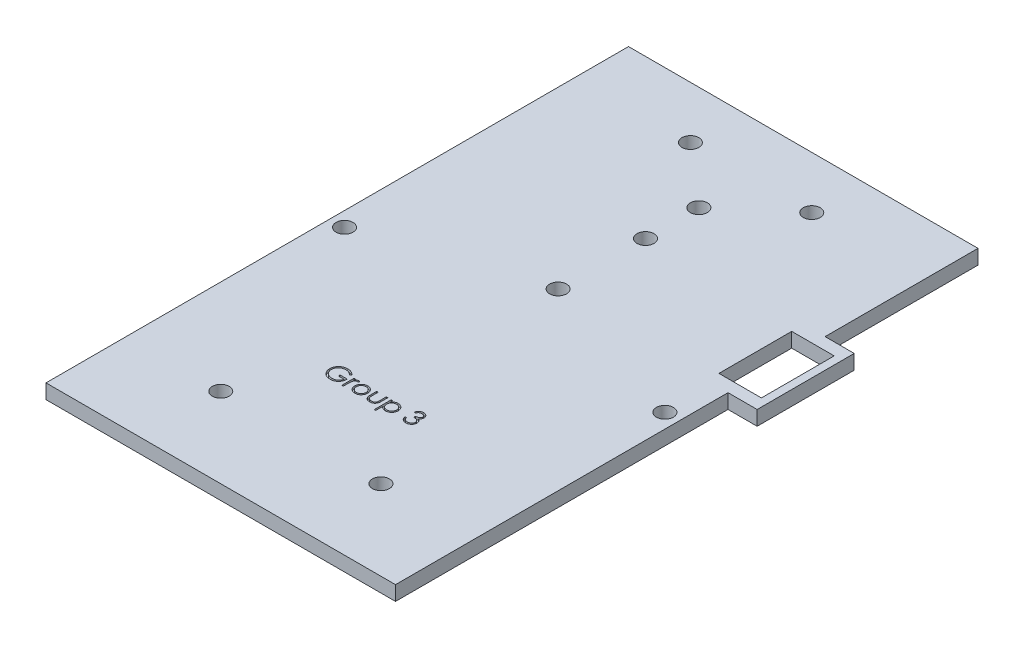
from build123d import *

# Parameters (mm, degrees)
SKETCH1_W           = 8.75
SKETCH1_H           = 15
SKETCH1_R           = 1.75
BOSS_EXTRUDE1_DEPTH = 3
CUT_EXTRUDE1_DEPTH  = 0.5


with BuildPart() as part:
    # Sketch1 → Boss-Extrude1 (new body)
    with BuildSketch(Plane(origin=(0, 0, 0), x_dir=(1, 0, 0), z_dir=(0, 1, 0))):
        Polygon((-36, -60), (36, -60), (36, 8.5), (42, 8.5), (42, 28.5), (36, 28.5), (36, 60), (-36, 60), align=None)
        with Locations((36, 18.5)):
            Rectangle(SKETCH1_W, SKETCH1_H, mode=Mode.SUBTRACT)
        with Locations(Location((-16.5, -43.5, 0), (0, 0, 270))):
            Circle(SKETCH1_R, mode=Mode.SUBTRACT)
        with Locations(Location((-33, -1.5, 0), (0, 0, 270))):
            Circle(SKETCH1_R, mode=Mode.SUBTRACT)
        with Locations(Location((16.5, -43.5, 0), (0, 0, 270))):
            Circle(SKETCH1_R, mode=Mode.SUBTRACT)
        with Locations(Location((33, -1.5, 0), (0, 0, 270))):
            Circle(SKETCH1_R, mode=Mode.SUBTRACT)
        with Locations(Location((0, 38.5, 0), (0, 0, 270))):
            Circle(SKETCH1_R, mode=Mode.SUBTRACT)
        with Locations(Location((-12.5, 49.25, 0), (0, 0, 270))):
            Circle(SKETCH1_R, mode=Mode.SUBTRACT)
        with Locations(Location((0, 9.5, 0), (0, 0, 270))):
            Circle(SKETCH1_R, mode=Mode.SUBTRACT)
        with Locations(Location((0, 27.5, 0), (0, 0, 270))):
            Circle(SKETCH1_R, mode=Mode.SUBTRACT)
        with Locations(Location((12.5, 49.25, 0), (0, 0, 270))):
            Circle(SKETCH1_R, mode=Mode.SUBTRACT)
    extrude(amount=BOSS_EXTRUDE1_DEPTH)

    # Sketch2 → Cut-Extrude1 (cut)
    # profile 1 of 6: a face of its own
    with BuildSketch(Plane(origin=(0, 3, 0), x_dir=(1, 0, 0), z_dir=(0, 1, 0))):
        with BuildLine():
            Line((-5.855769231, -27.097355769), (-6.125, -27.352564103))
            add(Edge.make_bspline(
                [(-6.125, -27.352564103), (-6.173718888, -27.30673324), (-6.269994935, -27.216164377), (-6.426955177, -27.098653381), (-6.590718811, -26.997987281), (-6.760431308, -26.916081045), (-6.931889862, -26.850728284), (-7.102818638, -26.804200144), (-7.27146434, -26.774527607), (-7.383631558, -26.770979237), (-7.438902244, -26.769230769)],
                knots=[0, 0, 0, 0, 1.08915593, 2.152340314, 3.188132944, 4.216796309, 5.218260357, 6.173443236, 7.099959455, 8, 8, 8, 8], degree=3))
            add(Edge.make_bspline(
                [(-7.438902244, -26.769230769), (-7.472816944, -26.769644375), (-7.540558384, -26.770470514), (-7.641180328, -26.781014729), (-7.740746965, -26.796179594), (-7.83907034, -26.818121471), (-7.936341626, -26.845930531), (-8.032222519, -26.880715994), (-8.126891873, -26.921271238), (-8.219457954, -26.968133712), (-8.309198458, -27.019613558), (-8.393955294, -27.076662099), (-8.474268692, -27.137450889), (-8.548629118, -27.203501868), (-8.617464304, -27.274216734), (-8.682412676, -27.34828004), (-8.741189972, -27.427715258), (-8.794281137, -27.511060884), (-8.841642756, -27.596853074), (-8.883451409, -27.684266063), (-8.918548497, -27.773009918), (-8.946317953, -27.863195995), (-8.969228606, -27.954126585), (-8.985346214, -28.046431306), (-8.994432936, -28.140208991), (-8.996004716, -28.20300625), (-8.996794872, -28.234575321)],
                knots=[0, 0, 0, 0, 1.02818874, 2.053710826, 3.065248034, 4.081641283, 5.106893873, 6.131558223, 7.173050175, 8.228653731, 9.27666206, 10.308777013, 11.325269123, 12.329503258, 13.32196095, 14.316845687, 15.314881793, 16.315733098, 17.311955233, 18.285320748, 19.252783886, 20.203351036, 21.145449891, 22.095197417, 23.042428769, 24, 24, 24, 24], degree=3))
            add(Edge.make_bspline(
                [(-8.996794872, -28.234575321), (-8.996039154, -28.266846138), (-8.994529781, -28.331299651), (-8.984869461, -28.427493724), (-8.966941221, -28.522259126), (-8.942973512, -28.615907259), (-8.912992696, -28.708598507), (-8.87562003, -28.799931017), (-8.831354429, -28.889901408), (-8.780117877, -28.977699025), (-8.723931674, -29.063222049), (-8.660988593, -29.14378157), (-8.59412801, -29.220450348), (-8.52091411, -29.291526111), (-8.443694567, -29.358910008), (-8.360162291, -29.42074553), (-8.271959831, -29.478223753), (-8.178952619, -29.530620272), (-8.082149837, -29.577428808), (-7.982893084, -29.619052704), (-7.880865268, -29.653332041), (-7.776602578, -29.681270145), (-7.670229307, -29.704170443), (-7.561205504, -29.718902923), (-7.450332796, -29.729593754), (-7.375594163, -29.730375424), (-7.337940705, -29.730769231)],
                knots=[0, 0, 0, 0, 0.93586088, 1.869166235, 2.799637598, 3.729985548, 4.670839027, 5.622275134, 6.589130586, 7.576015415, 8.568469353, 9.55398029, 10.53834874, 11.515998671, 12.510579167, 13.508179873, 14.527009472, 15.561807829, 16.601455013, 17.643573243, 18.680854198, 19.719860599, 20.772568776, 21.833555941, 22.908541556, 24, 24, 24, 24], degree=3))
            add(Edge.make_bspline(
                [(-7.337940705, -29.730769231), (-7.292562358, -29.729820654), (-7.203454601, -29.727957971), (-7.072468158, -29.713457681), (-6.946665087, -29.690810888), (-6.826398884, -29.657644991), (-6.711529863, -29.615341316), (-6.601636922, -29.56434593), (-6.497585263, -29.50270287), (-6.39906209, -29.433129003), (-6.308304904, -29.355614171), (-6.22645078, -29.271969716), (-6.154805291, -29.182601649), (-6.092300592, -29.088036334), (-6.040591937, -28.987491029), (-5.998149142, -28.881458466), (-5.965615851, -28.769890954), (-5.952260876, -28.692799323), (-5.945512821, -28.653846154)],
                knots=[0, 0, 0, 0, 1.13008108, 2.219097802, 3.278683437, 4.311054135, 5.322181354, 6.324827112, 7.324222904, 8.330512327, 9.32562643, 10.293043162, 11.24128371, 12.174520618, 13.111833804, 14.052305215, 15.015860969, 16, 16, 16, 16], degree=3))
            Line((-5.945512821, -28.653846154), (-7.112179487, -28.653846154))
            Line((-7.112179487, -28.653846154), (-7.112179487, -28.294871795))
            Line((-7.112179487, -28.294871795), (-5.631410256, -28.294871795))
            add(Edge.make_bspline(
                [(-5.631410256, -28.294871795), (-5.633116105, -28.361779284), (-5.636454758, -28.492729325), (-5.659873674, -28.683699596), (-5.697690186, -28.86407129), (-5.749350498, -29.034034361), (-5.816225778, -29.193347954), (-5.897598307, -29.34217382), (-5.994770428, -29.479550501), (-6.104280869, -29.606599505), (-6.227180827, -29.719928717), (-6.360149447, -29.819534655), (-6.503406415, -29.90343727), (-6.656816223, -29.971697933), (-6.819876656, -30.024971927), (-6.992965036, -30.062743504), (-7.175846637, -30.085373467), (-7.301183314, -30.088264847), (-7.365284455, -30.08974359)],
                knots=[0, 0, 0, 0, 1.140356446, 2.231883559, 3.274166699, 4.278491846, 5.25512956, 6.21435461, 7.1637429, 8.11826594, 9.068280886, 10.0076534, 10.945064095, 11.891975133, 12.864533718, 13.863980011, 14.907571808, 16, 16, 16, 16], degree=3))
            add(Edge.make_bspline(
                [(-7.365284455, -30.08974359), (-7.40479459, -30.089174469), (-7.482721311, -30.088051978), (-7.597812239, -30.080074631), (-7.70972986, -30.067794054), (-7.818457869, -30.049248931), (-7.924396211, -30.026534277), (-8.027015796, -29.997447558), (-8.126707538, -29.963778859), (-8.223625524, -29.925483185), (-8.31689007, -29.881111528), (-8.406916587, -29.831801889), (-8.494202713, -29.777808528), (-8.578153878, -29.718197682), (-8.6592075, -29.653415222), (-8.736840943, -29.583331303), (-8.811488821, -29.508160184), (-8.858249285, -29.454781174), (-8.881810897, -29.427884615)],
                knots=[0, 0, 0, 0, 1.107784379, 2.184907829, 3.233506516, 4.263428166, 5.276301166, 6.270063455, 7.25232949, 8.225834625, 9.190232166, 10.146266622, 11.1027726, 12.066435141, 13.031522626, 14.010570082, 14.99756817, 16, 16, 16, 16], degree=3))
            add(Edge.make_bspline(
                [(-8.881810897, -29.427884615), (-8.915996829, -29.385213962), (-8.983801242, -29.300580945), (-9.071079399, -29.164981001), (-9.145480801, -29.024579141), (-9.205848624, -28.878984512), (-9.25298671, -28.728333299), (-9.286792963, -28.572818008), (-9.306600252, -28.412238378), (-9.309453789, -28.303573113), (-9.310897436, -28.248597756)],
                knots=[0, 0, 0, 0, 1.023165419, 2.029347347, 3.013907458, 3.994755782, 4.975994455, 5.96558838, 6.970761222, 8, 8, 8, 8], degree=3))
            add(Edge.make_bspline(
                [(-9.310897436, -28.248597756), (-9.310365198, -28.207431504), (-9.309307486, -28.125622196), (-9.29648197, -28.004164889), (-9.278080552, -27.884864197), (-9.251033497, -27.76781764), (-9.216937232, -27.652947049), (-9.174383746, -27.540199085), (-9.12483885, -27.429507213), (-9.067253354, -27.321633345), (-9.003168895, -27.218008932), (-8.933618675, -27.119051129), (-8.857615074, -27.026562064), (-8.776399275, -26.939370416), (-8.689002285, -26.858571569), (-8.596242861, -26.783417458), (-8.498049518, -26.713807272), (-8.394113338, -26.650837438), (-8.285985654, -26.594273817), (-8.173925652, -26.544684605), (-8.057967541, -26.50370129), (-7.938980064, -26.46892751), (-7.816062563, -26.44321237), (-7.690107026, -26.424563624), (-7.560456914, -26.411803025), (-7.472820885, -26.410776769), (-7.428385417, -26.41025641)],
                knots=[0, 0, 0, 0, 1.008945113, 2.00506715, 2.99143336, 3.967273523, 4.948097931, 5.927297278, 6.919902385, 7.919676788, 8.923139349, 9.905703106, 10.883022732, 11.856032218, 12.825136022, 13.798837087, 14.781400844, 15.773989409, 16.776158564, 17.77167057, 18.775803737, 19.789618931, 20.80898985, 21.851988756, 22.910860228, 24, 24, 24, 24], degree=3))
            add(Edge.make_bspline(
                [(-7.428385417, -26.41025641), (-7.392147173, -26.410835902), (-7.320290994, -26.411984966), (-7.213365262, -26.419949614), (-7.108092247, -26.432573495), (-7.004315857, -26.449800282), (-6.902389491, -26.473263972), (-6.802022786, -26.501342257), (-6.70307025, -26.53403408), (-6.605842, -26.573022926), (-6.509684284, -26.617276551), (-6.414062444, -26.667089973), (-6.319303198, -26.723314978), (-6.225242216, -26.786118513), (-6.131286359, -26.854421931), (-6.038921716, -26.930178755), (-5.945918772, -27.010401511), (-5.886116958, -27.068083695), (-5.855769231, -27.097355769)],
                knots=[0, 0, 0, 0, 0.985871117, 1.954866573, 2.915460327, 3.869826059, 4.81536089, 5.759505086, 6.70452669, 7.649098992, 8.607881297, 9.583363685, 10.581137262, 11.603961102, 12.659522466, 13.73993555, 14.853081303, 16, 16, 16, 16], degree=3))
        make_face()
    # profile 2 of 6: a face of its own
    with BuildSketch(Plane(origin=(0, 3, 0), x_dir=(1, 0, 0), z_dir=(0, 1, 0))):
        with BuildLine():
            Line((-5.092948718, -27.442307692), (-4.778846154, -27.442307692))
            Line((-4.778846154, -27.442307692), (-4.778846154, -27.818810096))
            add(Edge.make_bspline(
                [(-4.778846154, -27.818810096), (-4.755657395, -27.783754268), (-4.711309074, -27.716710269), (-4.637596145, -27.628040968), (-4.562092814, -27.554625921), (-4.484437626, -27.496122402), (-4.404059526, -27.452309283), (-4.322722575, -27.420216248), (-4.239147105, -27.401238933), (-4.182985181, -27.398705274), (-4.154847756, -27.397435897)],
                knots=[0, 0, 0, 0, 1.2804753, 2.448899062, 3.506932113, 4.484331642, 5.4025378, 6.288909075, 7.142734305, 8, 8, 8, 8], degree=3))
            add(Edge.make_bspline(
                [(-4.154847756, -27.397435897), (-4.13302143, -27.398626424), (-4.088112345, -27.40107601), (-4.020129755, -27.418286835), (-3.950086303, -27.445764857), (-3.904943916, -27.47160508), (-3.881410256, -27.485076122)],
                knots=[0, 0, 0, 0, 0.901110191, 1.854092781, 2.881294221, 4, 4, 4, 4], degree=3))
            Line((-3.881410256, -27.485076122), (-4.053886218, -27.757111378))
            add(Edge.make_bspline(
                [(-4.053886218, -27.757111378), (-4.068995239, -27.750371112), (-4.097675054, -27.737576797), (-4.13962962, -27.722434787), (-4.178310957, -27.713518871), (-4.202954515, -27.712168153), (-4.214443109, -27.711538462)],
                knots=[0, 0, 0, 0, 1.180555205, 2.24091978, 3.179933427, 4, 4, 4, 4], degree=3))
            add(Edge.make_bspline(
                [(-4.214443109, -27.711538462), (-4.239648842, -27.713218499), (-4.291061232, -27.716645288), (-4.366545732, -27.743584096), (-4.439792937, -27.787109336), (-4.4979646, -27.835380448), (-4.543006853, -27.881928245), (-4.575147078, -27.922576648), (-4.604629825, -27.968155279), (-4.632800045, -28.017884963), (-4.65846634, -28.072614809), (-4.682421009, -28.131798023), (-4.704079872, -28.195503151), (-4.716430116, -28.239885672), (-4.72275641, -28.262620192)],
                knots=[0, 0, 0, 0, 1.125678352, 2.296057538, 3.5422874, 4.923748041, 5.663163013, 6.437101912, 7.23742474, 8.08941207, 8.991984279, 9.93940061, 10.944477711, 12, 12, 12, 12], degree=3))
            add(Edge.make_bspline(
                [(-4.72275641, -28.262620192), (-4.727488804, -28.282897366), (-4.737970695, -28.327809765), (-4.748162233, -28.403158289), (-4.758231751, -28.492181948), (-4.765328369, -28.595128541), (-4.771906412, -28.711740985), (-4.775616494, -28.84219693), (-4.778719634, -28.986630282), (-4.778802701, -29.087604635), (-4.778846154, -29.140424679)],
                knots=[0, 0, 0, 0, 0.566838948, 1.255505196, 2.06880316, 3.007127437, 4.065329342, 5.249902469, 6.561414163, 8, 8, 8, 8], degree=3))
            Line((-4.778846154, -29.140424679), (-4.778846154, -30))
            Line((-4.778846154, -30), (-5.092948718, -30))
            Line((-5.092948718, -30), (-5.092948718, -27.442307692))
        make_face()
    # profile 3 of 6: a face of its own
    with BuildSketch(Plane(origin=(0, 3, 0), x_dir=(1, 0, 0), z_dir=(0, 1, 0))):
        with BuildLine():
            add(Edge.make_bspline(
                [(-2.33193109, -27.397435897), (-2.283939817, -27.398457789), (-2.189840659, -27.400461467), (-2.052032773, -27.421876433), (-1.920487638, -27.454623797), (-1.794701445, -27.499895359), (-1.67628515, -27.56057731), (-1.563513906, -27.632986601), (-1.456696897, -27.718769195), (-1.392673868, -27.785127263), (-1.360176282, -27.818810096)],
                knots=[0, 0, 0, 0, 1.054011418, 2.066658804, 3.057071809, 4.030435133, 4.997543892, 5.974964718, 6.972108034, 8, 8, 8, 8], degree=3))
            add(Edge.make_bspline(
                [(-1.360176282, -27.818810096), (-1.332194328, -27.851024082), (-1.276771948, -27.914828624), (-1.205706229, -28.018284237), (-1.144484669, -28.125424338), (-1.095421708, -28.237671664), (-1.056736684, -28.354046336), (-1.029270988, -28.474948347), (-1.012934053, -28.600110694), (-1.010731086, -28.685114532), (-1.009615385, -28.728165064)],
                knots=[0, 0, 0, 0, 1.025258237, 2.030674902, 3.01204498, 3.988269485, 4.97094183, 5.956517959, 6.965070386, 8, 8, 8, 8], degree=3))
            add(Edge.make_bspline(
                [(-1.009615385, -28.728165064), (-1.010596722, -28.771465122), (-1.01253589, -28.857028055), (-1.030879507, -28.983047421), (-1.059410593, -29.105242244), (-1.100242431, -29.223100937), (-1.15260054, -29.336983765), (-1.216491227, -29.446393314), (-1.292362845, -29.551545447), (-1.378366841, -29.651547286), (-1.473418718, -29.7437135), (-1.576534866, -29.82404177), (-1.6856889, -29.892863294), (-1.802332253, -29.94829971), (-1.92539974, -29.99200941), (-2.055156808, -30.022709427), (-2.191401878, -30.04127111), (-2.2844291, -30.043654684), (-2.33193109, -30.044871795)],
                knots=[0, 0, 0, 0, 0.998656419, 1.973391657, 2.932242238, 3.890759089, 4.846373663, 5.82037756, 6.809684879, 7.83454468, 8.860553229, 9.859544525, 10.845671541, 11.83227036, 12.833544569, 13.85385346, 14.904124723, 16, 16, 16, 16], degree=3))
            add(Edge.make_bspline(
                [(-2.33193109, -30.044871795), (-2.379665809, -30.043650599), (-2.473156669, -30.041258824), (-2.609882651, -30.022781541), (-2.73987227, -29.992023559), (-2.863100868, -29.948156066), (-2.980245715, -29.892861522), (-3.090032212, -29.824249833), (-3.193232128, -29.743689678), (-3.288304112, -29.651553741), (-3.374302718, -29.551543784), (-3.450175726, -29.446393746), (-3.514066052, -29.336983652), (-3.566424256, -29.223100967), (-3.607256069, -29.105242236), (-3.635787161, -28.983047423), (-3.654130776, -28.857028055), (-3.656069945, -28.771465122), (-3.657051282, -28.728165064)],
                knots=[0, 0, 0, 0, 1.099876186, 2.154163076, 3.173186993, 4.173200201, 5.163417411, 6.152872554, 7.150605724, 8.17532212, 9.198891216, 10.186952605, 11.159729845, 12.11414092, 13.071450619, 14.029093627, 15.002601286, 16, 16, 16, 16], degree=3))
            add(Edge.make_bspline(
                [(-3.657051282, -28.728165064), (-3.655927972, -28.685348518), (-3.65370401, -28.600579116), (-3.637383501, -28.475652055), (-3.610024945, -28.354954666), (-3.571293548, -28.23902919), (-3.521778357, -28.127273754), (-3.461417069, -28.019868923), (-3.389626437, -27.916881123), (-3.334424485, -27.853159043), (-3.306490385, -27.820913462)],
                knots=[0, 0, 0, 0, 1.031353054, 2.041901799, 3.029428768, 4.008703097, 4.981709435, 5.96992636, 6.972712378, 8, 8, 8, 8], degree=3))
            add(Edge.make_bspline(
                [(-3.306490385, -27.820913462), (-3.274041794, -27.786938522), (-3.21022593, -27.720120826), (-3.102877202, -27.634588302), (-2.990383381, -27.560672228), (-2.870658455, -27.501196013), (-2.744975597, -27.454357495), (-2.612756354, -27.42179198), (-2.474480839, -27.400538625), (-2.379921218, -27.398480447), (-2.33193109, -27.397435897)],
                knots=[0, 0, 0, 0, 1.027980169, 2.021703884, 2.998553061, 3.971491411, 4.943284454, 5.930300938, 6.949603206, 8, 8, 8, 8], degree=3))
        make_face()
        with BuildLine():
            add(Edge.make_bspline(
                [(-2.333333333, -27.711538462), (-2.367270945, -27.712503053), (-2.434270073, -27.714407336), (-2.532889658, -27.72889124), (-2.627829812, -27.751838745), (-2.719270656, -27.784442801), (-2.806903829, -27.8265417), (-2.890813231, -27.87825006), (-2.971245671, -27.938883016), (-3.046627734, -28.008345688), (-3.115810046, -28.084224683), (-3.176288023, -28.165073041), (-3.227713129, -28.249579388), (-3.270553288, -28.337831599), (-3.302460476, -28.430724013), (-3.325633499, -28.527204644), (-3.340103739, -28.62747006), (-3.341990118, -28.695631079), (-3.342948718, -28.730268429)],
                knots=[0, 0, 0, 0, 1.021534396, 2.016698045, 2.994645724, 3.958388632, 4.93408049, 5.916473867, 6.921342795, 7.962252576, 8.998418191, 10.008913653, 10.997312074, 11.973003931, 12.956656626, 13.948281152, 14.957379055, 16, 16, 16, 16], degree=3))
            add(Edge.make_bspline(
                [(-3.342948718, -28.730268429), (-3.341341894, -28.775020457), (-3.33815265, -28.863844862), (-3.312217413, -28.994655985), (-3.268831134, -29.120237837), (-3.210243854, -29.239854223), (-3.136837635, -29.350526501), (-3.050350568, -29.449197985), (-2.951710868, -29.534383797), (-2.842094368, -29.605064642), (-2.72374005, -29.661224398), (-2.598483729, -29.701023374), (-2.467843035, -29.726895066), (-2.378562304, -29.729466541), (-2.333333333, -29.730769231)],
                knots=[0, 0, 0, 0, 1.016792936, 2.018143844, 3.017858371, 4.030088057, 5.03801393, 6.028138512, 7.003788237, 7.991172063, 8.984598303, 9.972568034, 10.972917682, 12, 12, 12, 12], degree=3))
            add(Edge.make_bspline(
                [(-2.333333333, -29.730769231), (-2.288106964, -29.729458951), (-2.198831368, -29.726872494), (-2.068372192, -29.701153674), (-1.94345822, -29.661050013), (-1.825226832, -29.605127803), (-1.715660229, -29.534115389), (-1.616311107, -29.449679012), (-1.530562496, -29.35026516), (-1.457228891, -29.239707631), (-1.397682149, -29.120423279), (-1.354498947, -28.994632807), (-1.328501361, -28.863850765), (-1.325320532, -28.775022434), (-1.323717949, -28.730268429)],
                knots=[0, 0, 0, 0, 1.02726834, 2.027799167, 3.010890988, 4.004497153, 4.992059811, 5.971914811, 6.958719428, 7.966827853, 8.981595046, 9.981490638, 10.983022906, 12, 12, 12, 12], degree=3))
            add(Edge.make_bspline(
                [(-1.323717949, -28.730268429), (-1.324676219, -28.695630872), (-1.326561948, -28.627469446), (-1.341036912, -28.527206993), (-1.364192452, -28.430715396), (-1.396164069, -28.337863393), (-1.438818083, -28.249350888), (-1.491234876, -28.165321161), (-1.551465901, -28.083944615), (-1.621483022, -28.008590974), (-1.6967864, -27.938855938), (-1.777251438, -27.878226548), (-1.861036417, -27.826768953), (-1.948415, -27.784082712), (-2.039867567, -27.752135372), (-2.134674697, -27.728758741), (-2.232873506, -27.714468544), (-2.29963255, -27.712521402), (-2.333333333, -27.711538462)],
                knots=[0, 0, 0, 0, 1.042956736, 2.052379634, 3.044323526, 4.02829302, 5.004299113, 5.996692471, 7.007513377, 8.048758398, 9.090003419, 10.095195979, 11.07790575, 12.047570684, 13.018257071, 13.989683339, 14.985167495, 16, 16, 16, 16], degree=3))
        make_face(mode=Mode.SUBTRACT)
    # profile 4 of 6: a face of its own
    with BuildSketch(Plane(origin=(0, 3, 0), x_dir=(1, 0, 0), z_dir=(0, 1, 0))):
        with BuildLine():
            Line((-0.426282051, -27.442307692), (-0.112179487, -27.442307692))
            Line((-0.112179487, -27.442307692), (-0.112179487, -28.628605769))
            add(Edge.make_bspline(
                [(-0.112179487, -28.628605769), (-0.112037582, -28.663428518), (-0.111766125, -28.730042806), (-0.109925184, -28.825897993), (-0.10559509, -28.913314706), (-0.100181266, -28.992343443), (-0.09321913, -29.062970834), (-0.084935769, -29.124950191), (-0.075677348, -29.178984375), (-0.066614634, -29.211527731), (-0.06239984, -29.22666266)],
                knots=[0, 0, 0, 0, 1.388932606, 2.656963016, 3.823490214, 4.879454478, 5.816252168, 6.653371382, 7.373723809, 8, 8, 8, 8], degree=3))
            add(Edge.make_bspline(
                [(-0.06239984, -29.22666266), (-0.055638385, -29.245685531), (-0.042256044, -29.283335792), (-0.01798256, -29.337724798), (0.012045777, -29.38810008), (0.044905604, -29.436404153), (0.082805012, -29.48120614), (0.125264483, -29.522430383), (0.17086272, -29.561634474), (0.238617744, -29.608019266), (0.33127701, -29.657734597), (0.452929765, -29.700630415), (0.584833991, -29.726266235), (0.67599871, -29.72924049), (0.722856571, -29.730769231)],
                knots=[0, 0, 0, 0, 0.725840625, 1.436591201, 2.137033971, 2.831655856, 3.53531722, 4.242432219, 4.957935707, 5.694543706, 7.190802206, 8.724350549, 10.316345118, 12, 12, 12, 12], degree=3))
            add(Edge.make_bspline(
                [(0.722856571, -29.730769231), (0.769710078, -29.729207982), (0.860362947, -29.726187255), (0.990817916, -29.701403716), (1.11006933, -29.659998027), (1.216920282, -29.602190616), (1.310886122, -29.531448553), (1.38919054, -29.448439744), (1.453797795, -29.355790357), (1.482007216, -29.286666078), (1.49619391, -29.251903045)],
                knots=[0, 0, 0, 0, 1.157059328, 2.238695713, 3.266970494, 4.264342957, 5.228770407, 6.160125903, 7.074715775, 8, 8, 8, 8], degree=3))
            add(Edge.make_bspline(
                [(1.49619391, -29.251903045), (1.50038814, -29.237936746), (1.509660559, -29.207060671), (1.51962291, -29.154680922), (1.528597372, -29.092216318), (1.536260548, -29.019258109), (1.541725711, -28.935996957), (1.544671737, -28.842458881), (1.548000012, -28.73893752), (1.548050529, -28.666469761), (1.548076923, -28.628605769)],
                knots=[0, 0, 0, 0, 0.557542046, 1.232589297, 2.036731608, 2.971723315, 4.038036528, 5.22795436, 6.551621927, 8, 8, 8, 8], degree=3))
            Line((1.548076923, -28.628605769), (1.548076923, -27.442307692))
            Line((1.548076923, -27.442307692), (1.862179487, -27.442307692))
            Line((1.862179487, -27.442307692), (1.862179487, -28.6875))
            add(Edge.make_bspline(
                [(1.862179487, -28.6875), (1.861737792, -28.729807171), (1.860880844, -28.811888871), (1.855373501, -28.931172983), (1.845923888, -29.042335228), (1.831581203, -29.145434448), (1.814715528, -29.240391929), (1.792959255, -29.327329375), (1.766981018, -29.405978929), (1.737675503, -29.477720706), (1.703053635, -29.5427676), (1.666226615, -29.604503417), (1.623701843, -29.661396352), (1.578931608, -29.716278489), (1.529129953, -29.766420017), (1.475230094, -29.812971493), (1.417990674, -29.856644524), (1.356141476, -29.895735804), (1.290585413, -29.930952449), (1.221241556, -29.962168527), (1.147260558, -29.986871104), (1.069596921, -30.00818177), (0.987870141, -30.024896239), (0.902159008, -30.036682806), (0.812492392, -30.043908137), (0.751382932, -30.044545182), (0.720052083, -30.044871795)],
                knots=[0, 0, 0, 0, 1.493040784, 2.896703357, 4.213163133, 5.428574705, 6.569057535, 7.615249723, 8.588095153, 9.490268104, 10.346124644, 11.18633936, 12.024365274, 12.850166724, 13.684164916, 14.514361689, 15.362232829, 16.222528818, 17.093394965, 17.986930858, 18.902426812, 19.842810585, 20.827885679, 21.843828298, 22.894529745, 24, 24, 24, 24], degree=3))
            add(Edge.make_bspline(
                [(0.720052083, -30.044871795), (0.688955569, -30.044532088), (0.627848024, -30.043864532), (0.53817678, -30.036722724), (0.452228174, -30.024914553), (0.370307775, -30.008059336), (0.292333378, -29.987020266), (0.217989138, -29.96201673), (0.148145575, -29.930936249), (0.081963571, -29.895958691), (0.019961183, -29.856393416), (-0.038147395, -29.813025376), (-0.092284248, -29.765919313), (-0.142461316, -29.715271956), (-0.187974293, -29.66045502), (-0.229390334, -29.601909459), (-0.267347039, -29.540215371), (-0.30169983, -29.474152208), (-0.331211585, -29.401580198), (-0.357266831, -29.321283101), (-0.37857747, -29.232380585), (-0.395919938, -29.134948656), (-0.409871379, -29.029453615), (-0.419557521, -28.915285199), (-0.424973351, -28.792721507), (-0.425836413, -28.708071617), (-0.426282051, -28.664362981)],
                knots=[0, 0, 0, 0, 1.083640291, 2.129454052, 3.13281866, 4.105697902, 5.042300162, 5.946461698, 6.836384745, 7.703652036, 8.553297018, 9.397182691, 10.228592656, 11.052265423, 11.879314572, 12.708807002, 13.549817954, 14.402308542, 15.300838682, 16.27712199, 17.341985831, 18.484375296, 19.725102775, 21.0496083, 22.476576903, 24, 24, 24, 24], degree=3))
            Line((-0.426282051, -28.664362981), (-0.426282051, -27.442307692))
        make_face()
    # profile 5 of 6: a face of its own
    with BuildSketch(Plane(origin=(0, 3, 0), x_dir=(1, 0, 0), z_dir=(0, 1, 0))):
        with BuildLine():
            Line((2.580128205, -27.442307692), (2.894230769, -27.442307692))
            Line((2.894230769, -27.442307692), (2.894230769, -27.915564904))
            add(Edge.make_bspline(
                [(2.894230769, -27.915564904), (2.927588253, -27.87262717), (2.992411848, -27.789186277), (3.104136753, -27.681196149), (3.222063562, -27.590120845), (3.349226974, -27.518738312), (3.483650664, -27.4649175), (3.624782982, -27.42513805), (3.773821747, -27.401696576), (3.875718199, -27.398874914), (3.927684295, -27.397435897)],
                knots=[0, 0, 0, 0, 1.0828784, 2.104357462, 3.088488658, 4.04616522, 5.001424249, 5.969181776, 6.964304535, 8, 8, 8, 8], degree=3))
            add(Edge.make_bspline(
                [(3.927684295, -27.397435897), (3.973075898, -27.398749076), (4.062794786, -27.401344643), (4.194858015, -27.418917698), (4.322033399, -27.44903539), (4.443601453, -27.492436306), (4.560864518, -27.546091776), (4.672086618, -27.613808811), (4.779000173, -27.692215002), (4.878916363, -27.782447153), (4.97123773, -27.880075419), (5.051083911, -27.985097723), (5.119955816, -28.09406031), (5.175626112, -28.208652402), (5.219234459, -28.327971632), (5.250249137, -28.452500073), (5.268706781, -28.581776013), (5.271183232, -28.669678734), (5.272435897, -28.714142628)],
                knots=[0, 0, 0, 0, 1.041296284, 2.058176809, 3.050446431, 4.034000596, 5.01514041, 6.003636468, 7.015969324, 8.052561599, 9.08815499, 10.094063707, 11.074456064, 12.040834395, 13.011057502, 13.983766392, 14.980127149, 16, 16, 16, 16], degree=3))
            add(Edge.make_bspline(
                [(5.272435897, -28.714142628), (5.271210412, -28.759544937), (5.268793578, -28.849084841), (5.250048572, -28.980571938), (5.220091697, -29.107059312), (5.177033514, -29.228336576), (5.121392026, -29.344320227), (5.053687466, -29.454926623), (4.973800998, -29.560120326), (4.882499871, -29.658473226), (4.783446935, -29.749072539), (4.677569445, -29.828310609), (4.56651052, -29.894851984), (4.450838353, -29.950434944), (4.329562714, -29.992327128), (4.203249436, -30.022544929), (4.07196729, -30.041179424), (3.982666138, -30.043631567), (3.9375, -30.044871795)],
                knots=[0, 0, 0, 0, 1.038740735, 2.04854663, 3.033179607, 4.009277356, 4.987731542, 5.972001279, 6.972200261, 8.005528982, 9.039189865, 10.040446548, 11.026516639, 11.997840187, 12.972163198, 13.956796175, 14.96660207, 16, 16, 16, 16], degree=3))
            add(Edge.make_bspline(
                [(3.9375, -30.044871795), (3.886672428, -30.043576987), (3.786273072, -30.041019362), (3.639475402, -30.015099952), (3.49819855, -29.976363017), (3.364007725, -29.919664023), (3.235839912, -29.847408507), (3.114420107, -29.759298301), (2.999103354, -29.655517676), (2.929694596, -29.57678586), (2.894230769, -29.536558494)],
                knots=[0, 0, 0, 0, 1.014726462, 2.004382257, 2.969841629, 3.936926163, 4.907207904, 5.903978561, 6.929055279, 8, 8, 8, 8], degree=3))
            Line((2.894230769, -29.536558494), (2.894230769, -30.942307692))
            Line((2.894230769, -30.942307692), (2.580128205, -30.942307692))
            Line((2.580128205, -30.942307692), (2.580128205, -27.442307692))
        make_face()
        with BuildLine():
            add(Edge.make_bspline(
                [(3.924879808, -27.711538462), (3.889300245, -27.71217872), (3.819253257, -27.713439223), (3.716581038, -27.728413172), (3.617685611, -27.750150913), (3.523563659, -27.783062813), (3.433313043, -27.823461627), (3.347628878, -27.873943638), (3.26657131, -27.933595644), (3.19034428, -28.001274987), (3.121480987, -28.075849676), (3.060518059, -28.155437485), (3.009310754, -28.239937624), (2.966808733, -28.328562987), (2.934465451, -28.422008272), (2.911509731, -28.519741285), (2.897079378, -28.621868997), (2.895190441, -28.691425004), (2.894230769, -28.726762821)],
                knots=[0, 0, 0, 0, 1.05670511, 2.080379991, 3.077984906, 4.06214886, 5.038337365, 6.01289324, 7.01187578, 8.025460281, 9.038092164, 10.024533457, 11.000252242, 11.969694649, 12.940728589, 13.933144304, 14.949937299, 16, 16, 16, 16], degree=3))
            add(Edge.make_bspline(
                [(2.894230769, -28.726762821), (2.895821625, -28.773150933), (2.898938247, -28.864029174), (2.924275615, -28.996813296), (2.965510879, -29.122464952), (3.024039593, -29.239925989), (3.097987167, -29.347908824), (3.187085324, -29.44459943), (3.290527875, -29.529390021), (3.406595066, -29.600811275), (3.531017197, -29.658799341), (3.660803109, -29.700313552), (3.79416799, -29.72588578), (3.88433631, -29.729132599), (3.92978766, -29.730769231)],
                knots=[0, 0, 0, 0, 1.03728447, 2.032128127, 3.01272805, 3.987917167, 4.958271349, 5.931593992, 6.91984656, 7.941419022, 8.973179163, 9.983609215, 10.983593296, 12, 12, 12, 12], degree=3))
            add(Edge.make_bspline(
                [(3.92978766, -29.730769231), (3.974323428, -29.729212854), (4.062718921, -29.726123726), (4.192877043, -29.699385538), (4.319367681, -29.658540513), (4.439547854, -29.598980957), (4.552371341, -29.525990899), (4.654252895, -29.438430866), (4.743259808, -29.336940923), (4.819124163, -29.22393242), (4.880255649, -29.102757036), (4.926185889, -28.977375647), (4.952694462, -28.848230224), (4.956451251, -28.761232511), (4.958333333, -28.717648237)],
                knots=[0, 0, 0, 0, 1.00104056, 1.986885549, 2.97790532, 3.984399681, 4.995088187, 5.994304198, 6.996462723, 8.023150851, 9.048424203, 10.043036403, 11.019596776, 12, 12, 12, 12], degree=3))
            add(Edge.make_bspline(
                [(4.958333333, -28.717648237), (4.956878599, -28.673793248), (4.953980466, -28.586424944), (4.925433428, -28.457662041), (4.88253345, -28.331774065), (4.819974398, -28.212253516), (4.745773129, -28.099479433), (4.656026132, -27.999925554), (4.555409935, -27.912754881), (4.442720771, -27.840739471), (4.321780346, -27.783453976), (4.19446543, -27.741570337), (4.061421828, -27.716396588), (3.970794173, -27.713172082), (3.924879808, -27.711538462)],
                knots=[0, 0, 0, 0, 0.983928682, 1.960191568, 2.949917689, 3.96440592, 4.982380491, 5.975291189, 6.965713506, 7.964880129, 8.970154049, 9.96478489, 10.968906225, 12, 12, 12, 12], degree=3))
        make_face(mode=Mode.SUBTRACT)
    # profile 6 of 6: a face of its own
    with BuildSketch(Plane(origin=(0, 3, 0), x_dir=(1, 0, 0), z_dir=(0, 1, 0))):
        with BuildLine():
            Line((7.471153846, -27.307692308), (7.157051282, -27.307692308))
            add(Edge.make_bspline(
                [(7.157051282, -27.307692308), (7.165560833, -27.272459824), (7.182196308, -27.203583199), (7.216893882, -27.105175938), (7.254693137, -27.012052417), (7.300082242, -26.925956343), (7.349590996, -26.845157441), (7.406313717, -26.771488316), (7.46763344, -26.703075351), (7.535458389, -26.642362113), (7.606587051, -26.587384384), (7.682021671, -26.540509327), (7.760244564, -26.500185174), (7.841797697, -26.466964942), (7.926923869, -26.441939418), (8.014853492, -26.423782613), (8.105816992, -26.411991498), (8.167564583, -26.410840735), (8.198918269, -26.41025641)],
                knots=[0, 0, 0, 0, 1.162005537, 2.271625781, 3.343758855, 4.383309926, 5.390229558, 6.379919256, 7.361854164, 8.333198761, 9.295911338, 10.242430842, 11.177959212, 12.116337295, 13.062827104, 14.020064771, 14.994644689, 16, 16, 16, 16], degree=3))
            add(Edge.make_bspline(
                [(8.198918269, -26.41025641), (8.244601011, -26.411635641), (8.334970022, -26.414364016), (8.467733069, -26.439278452), (8.595759888, -26.478703585), (8.717649136, -26.533177312), (8.830867569, -26.600364625), (8.931603755, -26.680329362), (9.018492266, -26.771528663), (9.091386644, -26.872261228), (9.148461643, -26.979916737), (9.190548016, -27.090716894), (9.216169697, -27.204398866), (9.219490254, -27.281156145), (9.221153846, -27.319611378)],
                knots=[0, 0, 0, 0, 1.083050992, 2.142477498, 3.193116406, 4.255571735, 5.30263384, 6.308962982, 7.297363603, 8.282367274, 9.249857812, 10.179914175, 11.08814088, 12, 12, 12, 12], degree=3))
            add(Edge.make_bspline(
                [(9.221153846, -27.319611378), (9.219990255, -27.356618173), (9.217713288, -27.429034727), (9.198379582, -27.534756225), (9.16584332, -27.634397825), (9.120773557, -27.728378987), (9.062432007, -27.816103827), (8.99175931, -27.897769718), (8.908256648, -27.973738876), (8.84497771, -28.017258349), (8.81239984, -28.039663462)],
                knots=[0, 0, 0, 0, 1.024540389, 2.004866551, 2.965041327, 3.920577974, 4.882998113, 5.874504559, 6.905732034, 8, 8, 8, 8], degree=3))
            add(Edge.make_bspline(
                [(8.81239984, -28.039663462), (8.849631594, -28.057641633), (8.923398469, -28.093261591), (9.023948998, -28.163117348), (9.115226873, -28.243773696), (9.166130592, -28.306716348), (9.191706731, -28.338341346)],
                knots=[0, 0, 0, 0, 1.015518401, 2.012035669, 3.001164323, 4, 4, 4, 4], degree=3))
            add(Edge.make_bspline(
                [(9.191706731, -28.338341346), (9.208548073, -28.361399098), (9.241954969, -28.407137014), (9.283190503, -28.48067344), (9.320599617, -28.555024929), (9.349749837, -28.632184336), (9.372323703, -28.711257349), (9.388459736, -28.792379745), (9.398483877, -28.875617768), (9.399919429, -28.931930248), (9.400641026, -28.960236378)],
                knots=[0, 0, 0, 0, 1.025084078, 2.033381695, 3.024893161, 4.013698104, 4.991890475, 5.976764909, 6.982997093, 8, 8, 8, 8], degree=3))
            add(Edge.make_bspline(
                [(9.400641026, -28.960236378), (9.398846512, -29.009246099), (9.39526593, -29.107034901), (9.363261856, -29.251509623), (9.313648615, -29.392735125), (9.243191679, -29.527809964), (9.15732417, -29.654190345), (9.055166846, -29.767266654), (8.937880438, -29.864465259), (8.807074789, -29.945675487), (8.66535766, -30.010593409), (8.513782068, -30.055650852), (8.354532014, -30.084996852), (8.245324717, -30.08814372), (8.189803686, -30.08974359)],
                knots=[0, 0, 0, 0, 0.955779014, 1.907060117, 2.875433937, 3.871313158, 4.872415639, 5.851225146, 6.836215519, 7.83643374, 8.849228613, 9.86973379, 10.916971861, 12, 12, 12, 12], degree=3))
            add(Edge.make_bspline(
                [(8.189803686, -30.08974359), (8.152384386, -30.088875376), (8.078755681, -30.087167022), (7.970512182, -30.075488421), (7.867190483, -30.054158416), (7.768650885, -30.025455111), (7.674805849, -29.989063368), (7.585941743, -29.94374467), (7.50151185, -29.890433168), (7.422312899, -29.828499581), (7.348354331, -29.759218241), (7.281601607, -29.681359231), (7.220941814, -29.596361827), (7.167999175, -29.503238771), (7.120362222, -29.403193513), (7.081181266, -29.294945015), (7.046695697, -29.179460993), (7.030662233, -29.098983253), (7.022435897, -29.057692308)],
                knots=[0, 0, 0, 0, 1.048658725, 2.063410685, 3.046034179, 4.001477787, 4.936774919, 5.862367409, 6.792675028, 7.730719943, 8.675894397, 9.627829632, 10.600096036, 11.597688215, 12.626045268, 13.701542398, 14.82072376, 16, 16, 16, 16], degree=3))
            Line((7.022435897, -29.057692308), (7.336538462, -29.057692308))
            add(Edge.make_bspline(
                [(7.336538462, -29.057692308), (7.344721753, -29.084641321), (7.360638966, -29.137059493), (7.387733264, -29.212499798), (7.418601536, -29.281657851), (7.451716094, -29.345040973), (7.48649454, -29.403273376), (7.525409466, -29.454815245), (7.565578611, -29.501930447), (7.595857964, -29.528475059), (7.610677083, -29.541466346)],
                knots=[0, 0, 0, 0, 1.198163088, 2.33053128, 3.407730985, 4.417276592, 5.372219308, 6.28897303, 7.162600585, 8, 8, 8, 8], degree=3))
            add(Edge.make_bspline(
                [(7.610677083, -29.541466346), (7.63027366, -29.55657468), (7.669406323, -29.586744712), (7.733174554, -29.62524634), (7.80023944, -29.658607366), (7.872054114, -29.684091061), (7.947068885, -29.705668722), (8.02649625, -29.719789241), (8.109635467, -29.729477413), (8.16640323, -29.730332344), (8.19541266, -29.730769231)],
                knots=[0, 0, 0, 0, 0.946170439, 1.889420265, 2.845303464, 3.807233317, 4.801018734, 5.828864929, 6.890507805, 8, 8, 8, 8], degree=3))
            add(Edge.make_bspline(
                [(8.19541266, -29.730769231), (8.228166163, -29.730153326), (8.29221281, -29.728948976), (8.385667669, -29.717873269), (8.474575117, -29.701742856), (8.557948042, -29.676829873), (8.63687855, -29.646049021), (8.710260199, -29.607400616), (8.779056306, -29.562055894), (8.842385711, -29.510516736), (8.899331219, -29.454095241), (8.949470732, -29.39508217), (8.992095393, -29.33372634), (9.026478972, -29.269688219), (9.053629522, -29.20323299), (9.072112722, -29.134174161), (9.084964237, -29.063076895), (9.08601085, -29.014747926), (9.086538462, -28.990384615)],
                knots=[0, 0, 0, 0, 1.217147791, 2.380027433, 3.494444702, 4.572153297, 5.609568379, 6.639424714, 7.649109417, 8.668170816, 9.669597737, 10.625200337, 11.543417969, 12.441394052, 13.322311151, 14.205496177, 15.095365482, 16, 16, 16, 16], degree=3))
            add(Edge.make_bspline(
                [(9.086538462, -28.990384615), (9.08500816, -28.957773277), (9.081955172, -28.892712868), (9.058646592, -28.796995294), (9.020307728, -28.704771882), (8.966635217, -28.617616091), (8.901299488, -28.53684019), (8.824934581, -28.464768707), (8.736906353, -28.405298616), (8.655886484, -28.36420996), (8.584121327, -28.336172885), (8.522705943, -28.31749792), (8.453949339, -28.301684265), (8.37868299, -28.286971993), (8.296339774, -28.274450645), (8.207009336, -28.264008829), (8.110673574, -28.255653788), (8.043982409, -28.251922693), (8.009615385, -28.25)],
                knots=[0, 0, 0, 0, 1.07054697, 2.135767047, 3.216561865, 4.33974944, 5.486079747, 6.621378074, 7.775625952, 8.963672916, 9.598146892, 10.304877434, 11.070270905, 11.915000392, 12.823868403, 13.805723172, 14.86925407, 16, 16, 16, 16], degree=3))
            Line((8.009615385, -28.25), (8.009615385, -27.891025641))
            add(Edge.make_bspline(
                [(8.009615385, -27.891025641), (8.05291655, -27.890290837), (8.137732897, -27.888851537), (8.261627202, -27.871443527), (8.380100514, -27.847362899), (8.490527256, -27.810477707), (8.591175969, -27.76763741), (8.678495571, -27.7177852), (8.751262718, -27.662370451), (8.80912379, -27.600537842), (8.852653019, -27.534222794), (8.884479816, -27.465106136), (8.903280142, -27.392582076), (8.905789809, -27.343087408), (8.907051282, -27.318209135)],
                knots=[0, 0, 0, 0, 1.321986639, 2.589447074, 3.816329219, 5.01088745, 6.139805852, 7.153945165, 8.075214402, 8.924034688, 9.728124013, 10.488707548, 11.240355623, 12, 12, 12, 12], degree=3))
            add(Edge.make_bspline(
                [(8.907051282, -27.318209135), (8.906636871, -27.299931389), (8.90581242, -27.263568682), (8.895415142, -27.210443614), (8.879791101, -27.158942668), (8.858311372, -27.109284858), (8.829561173, -27.061814584), (8.795155187, -27.016127135), (8.754187087, -26.972483356), (8.70724164, -26.931803036), (8.656829835, -26.893033799), (8.60158006, -26.860120162), (8.543158185, -26.8319751), (8.48149953, -26.808765598), (8.416404, -26.79130631), (8.348177442, -26.778770468), (8.276689758, -26.770932813), (8.227918026, -26.769804398), (8.203125, -26.769230769)],
                knots=[0, 0, 0, 0, 0.884392785, 1.759457502, 2.611959086, 3.489218968, 4.37281399, 5.2945488, 6.255912374, 7.266815255, 8.301784654, 9.332968512, 10.37626691, 11.440494194, 12.520033166, 13.637162961, 14.798855837, 16, 16, 16, 16], degree=3))
            add(Edge.make_bspline(
                [(8.203125, -26.769230769), (8.163273332, -26.770622131), (8.085433756, -26.773339785), (7.973218839, -26.797142798), (7.868899505, -26.835120882), (7.789160838, -26.880453901), (7.730278264, -26.925204335), (7.688201326, -26.964286721), (7.646880815, -27.007719545), (7.609035138, -27.05817792), (7.570761162, -27.112244711), (7.5359166, -27.172668392), (7.502056908, -27.237872786), (7.481654358, -27.283968421), (7.471153846, -27.307692308)],
                knots=[0, 0, 0, 0, 1.472543308, 2.876219568, 4.221790263, 5.565193594, 6.249813518, 6.953379497, 7.687249741, 8.463570142, 9.283606569, 10.136032583, 11.040678096, 12, 12, 12, 12], degree=3))
        make_face()
    extrude(amount=-CUT_EXTRUDE1_DEPTH, mode=Mode.SUBTRACT)


solid = part.part
